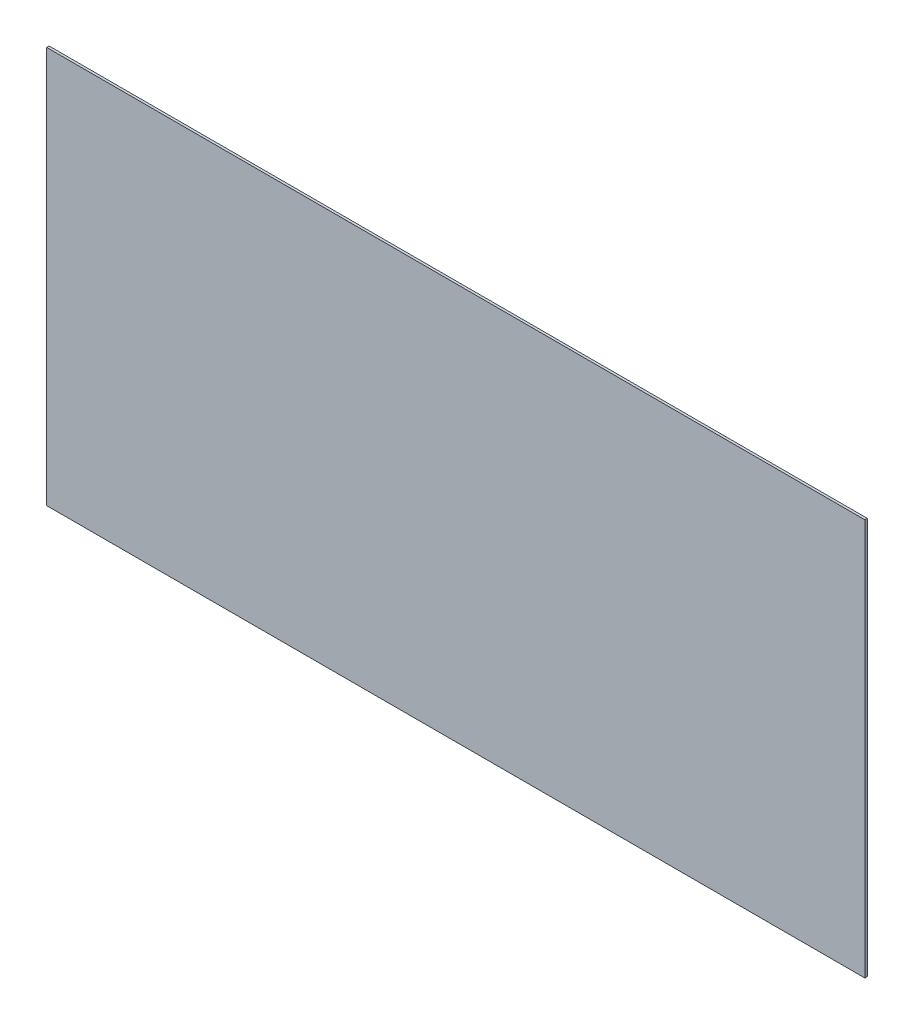
from build123d import *

# Parameters (mm, degrees)
ESBO_O1_W                = 67
ESBO_O1_H                = 32.5
RESSALTO_EXTRUS_O1_DEPTH = 0.2


with BuildPart() as part:
    # Esboço1 → Ressalto-extrusão1 (new body)
    with BuildSketch(Plane.XY):
        with Locations((7.987985213, -10.190850277)):
            Rectangle(ESBO_O1_W, ESBO_O1_H)
    extrude(amount=RESSALTO_EXTRUS_O1_DEPTH)


solid = part.part
